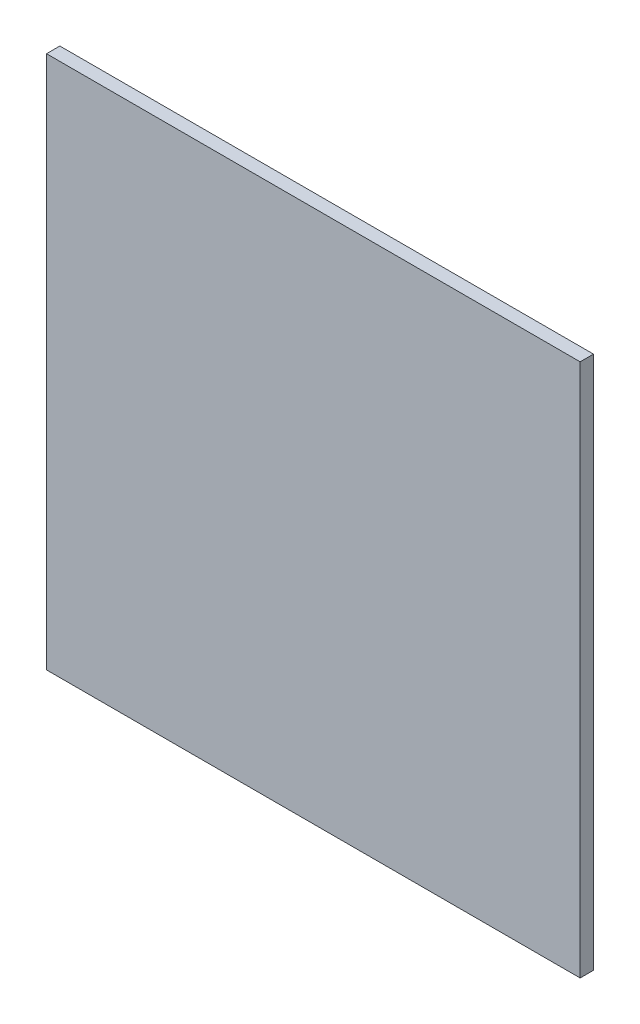
from build123d import *

# Parameters (mm, degrees)
SKETCH1_W           = 200
SKETCH1_H           = 200
BOSS_EXTRUDE1_DEPTH = 5


with BuildPart() as part:
    # Sketch1 → Boss-Extrude1 (new body)
    with BuildSketch(Plane.XY):
        Rectangle(SKETCH1_W, SKETCH1_H)
    extrude(amount=BOSS_EXTRUDE1_DEPTH)


solid = part.part
